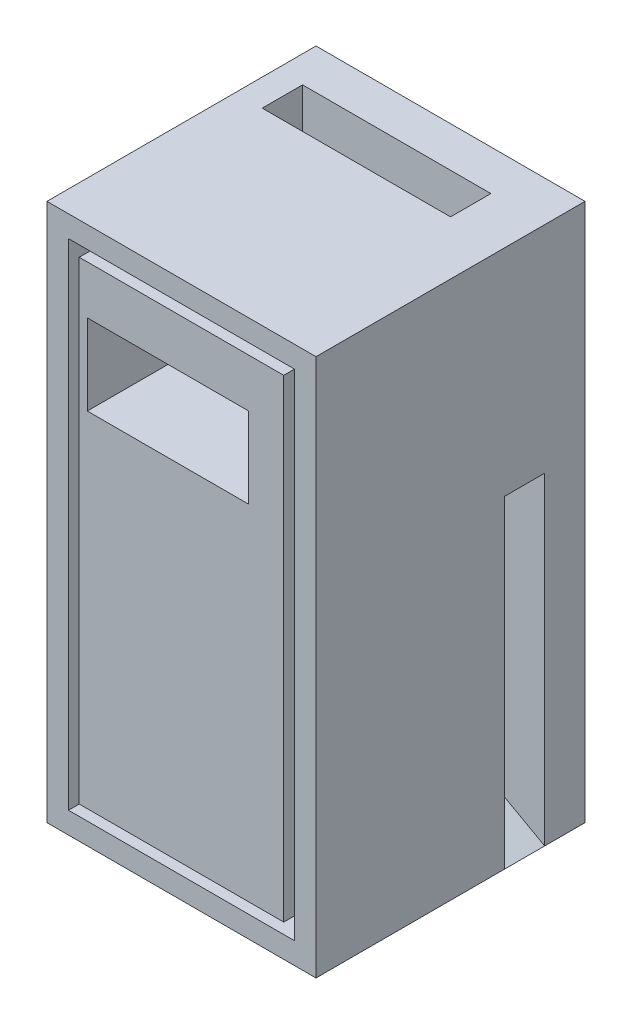
from build123d import *

# Parameters (mm, degrees)
BOSS_EXTRUDE1_DEPTH = 25
SKETCH2_W           = 50
SKETCH2_H           = 35
SKETCH2_H_2         = 7.5
BOSS_EXTRUDE2_DEPTH = 100
SKETCH3_W           = 5
SKETCH3_H           = 7.5
BOSS_EXTRUDE3_DEPTH = 75
SKETCH4_W           = 10
SKETCH4_H           = 40
BOSS_EXTRUDE4_DEPTH = 7.5
CUT_EXTRUDE1_REACH  = 122.52
SKETCH5_W           = 30
SKETCH5_H           = 15
SKETCH7_W           = 42
SKETCH7_H           = 92
SKETCH7_W_2         = 38
SKETCH7_H_2         = 88
CUT_EXTRUDE2_DEPTH  = 15


with BuildPart() as part:
    # Sketch1 → Boss-Extrude1 (new, symmetric)
    with BuildSketch(Plane.XY):
        Polygon((0, 0), (45, 0), (0, 25), (-5, 25), (-5, 0), align=None)
    extrude(amount=BOSS_EXTRUDE1_DEPTH, both=True)

    # Sketch2 → Boss-Extrude2 (add)
    with BuildSketch(Plane(origin=(0, 0, 0), x_dir=(1, 0, 0), z_dir=(0, 1, 0))):
        with Locations((20, -7.5)):
            Rectangle(SKETCH2_W, SKETCH2_H)
        with Locations((20, 21.25)):
            Rectangle(SKETCH2_W, SKETCH2_H_2)
    extrude(amount=BOSS_EXTRUDE2_DEPTH)

    # Sketch3 → Boss-Extrude3 (add)
    with BuildSketch(Plane(origin=(0, 25, 0), x_dir=(1, 0, 0), z_dir=(0, 1, 0))):
        with Locations((-2.5, 13.75)):
            Rectangle(SKETCH3_W, SKETCH3_H)
    extrude(amount=BOSS_EXTRUDE3_DEPTH)

    # Sketch4 → Boss-Extrude4 (add)
    with BuildSketch(Plane.XY.offset(-17.5)):
        with Locations((40, 80)):
            Rectangle(SKETCH4_W, SKETCH4_H)
    extrude(amount=BOSS_EXTRUDE4_DEPTH)

    # Sketch5 → Cut-Extrude1 (cut, up to next)
    with BuildSketch(Plane.XY.offset(25), mode=Mode.PRIVATE) as cut_extrude1_sk1:
        with Locations((17.5, 77.5)):
            Rectangle(SKETCH5_W, SKETCH5_H)
    cut_extrude1_tool1 = extrude(cut_extrude1_sk1.sketch, amount=-CUT_EXTRUDE1_REACH, mode=Mode.PRIVATE) & part.part
    add(cut_extrude1_tool1.solids().sort_by_distance((17.5, 77.5, 25))[0], mode=Mode.SUBTRACT)

    # Sketch7 → Cut-Extrude2 (cut)
    with BuildSketch(Plane.XY.offset(25)):
        with Locations((20, 50)):
            Rectangle(SKETCH7_W, SKETCH7_H)
        with Locations((20, 50)):
            Rectangle(SKETCH7_W_2, SKETCH7_H_2, mode=Mode.SUBTRACT)
    extrude(amount=-CUT_EXTRUDE2_DEPTH, mode=Mode.SUBTRACT)


solid = part.part
